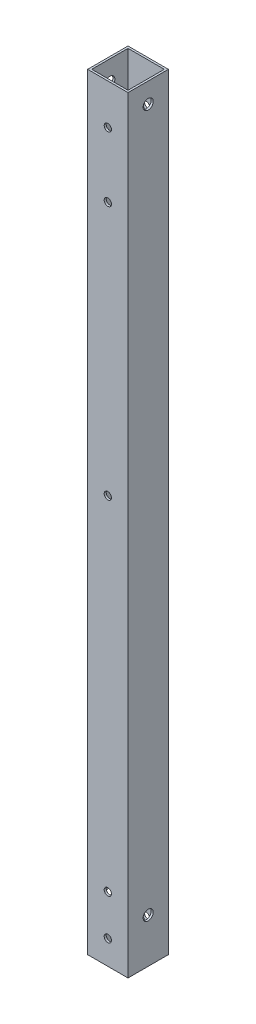
from build123d import *

# Parameters (mm, degrees)
SKETCH1_W           = 25.4
SKETCH1_H           = 25.4
BOSS_EXTRUDE1_DEPTH = 482.6
SKETCH2_R           = 2.286
CUT_EXTRUDE1_DEPTH  = 484.934995635
SKETCH3_R           = 2.286
CUT_EXTRUDE2_DEPTH  = 484.934995635
SKETCH4_R           = 2.286
CUT_EXTRUDE3_DEPTH  = 484.934995635
SKETCH6_R           = 2.286
CUT_EXTRUDE5_DEPTH  = 484.934995635
SKETCH7_R           = 2.286
CUT_EXTRUDE6_DEPTH  = 484.934995635
SKETCH8_R           = 3.175
CUT_EXTRUDE7_DEPTH  = 484.934995635
SKETCH9_R           = 3.175
CUT_EXTRUDE8_DEPTH  = 484.934995635


with BuildPart() as part:
    # Sketch1 → Boss-Extrude1 (new body)
    with BuildSketch(Plane(origin=(0, 0, 0), x_dir=(1, 0, 0), z_dir=(0, 1, 0))):
        with Locations((12.7, 12.7)):
            Rectangle(SKETCH1_W, SKETCH1_H)
        Polygon((1.27, 12.361459156), (1.27, 24.13), (12.7, 24.13), (24.13, 24.13), (24.13, 12.7), (24.13, 1.27), (12.7, 1.27), (1.27, 1.27), align=None, mode=Mode.SUBTRACT)
    extrude(amount=BOSS_EXTRUDE1_DEPTH)

    # Sketch2 → Cut-Extrude1 (cut, through all)
    with BuildSketch(Plane(origin=(0, 0, -25.4), x_dir=(-1, 0, 0), z_dir=(0, 0, -1))):
        with Locations((-12.7, 416.56)):
            Circle(SKETCH2_R)
    extrude(amount=-CUT_EXTRUDE1_DEPTH, mode=Mode.SUBTRACT)

    # Sketch3 → Cut-Extrude2 (cut, through all)
    with BuildSketch(Plane(origin=(0, 0, -25.4), x_dir=(-1, 0, 0), z_dir=(0, 0, -1))):
        with Locations((-12.7, 40.64)):
            Circle(SKETCH3_R)
    extrude(amount=-CUT_EXTRUDE2_DEPTH, mode=Mode.SUBTRACT)

    # Sketch4 → Cut-Extrude3 (cut, through all)
    with BuildSketch(Plane(origin=(0, 0, -25.4), x_dir=(-1, 0, 0), z_dir=(0, 0, -1))):
        with Locations((-12.7, 256.54)):
            Circle(SKETCH4_R)
    extrude(amount=-CUT_EXTRUDE3_DEPTH, mode=Mode.SUBTRACT)

    # Sketch6 → Cut-Extrude5 (cut, through all)
    with BuildSketch(Plane(origin=(0, 0, -25.4), x_dir=(-1, 0, 0), z_dir=(0, 0, -1))):
        with Locations((-12.7, 457.2)):
            Circle(SKETCH6_R)
    extrude(amount=-CUT_EXTRUDE5_DEPTH, mode=Mode.SUBTRACT)

    # Sketch7 → Cut-Extrude6 (cut, through all)
    with BuildSketch(Plane(origin=(0, 0, -25.4), x_dir=(-1, 0, 0), z_dir=(0, 0, -1))):
        with Locations((-12.7, 15.24)):
            Circle(SKETCH7_R)
    extrude(amount=-CUT_EXTRUDE6_DEPTH, mode=Mode.SUBTRACT)

    # Sketch8 → Cut-Extrude7 (cut, through all)
    with BuildSketch(Plane.ZY):
        with Locations((-12.7, 469.9)):
            Circle(SKETCH8_R)
    extrude(amount=-CUT_EXTRUDE7_DEPTH, mode=Mode.SUBTRACT)

    # Sketch9 → Cut-Extrude8 (cut, through all)
    with BuildSketch(Plane.ZY):
        with Locations((-12.7, 27.94)):
            Circle(SKETCH9_R)
    extrude(amount=-CUT_EXTRUDE8_DEPTH, mode=Mode.SUBTRACT)


solid = part.part
